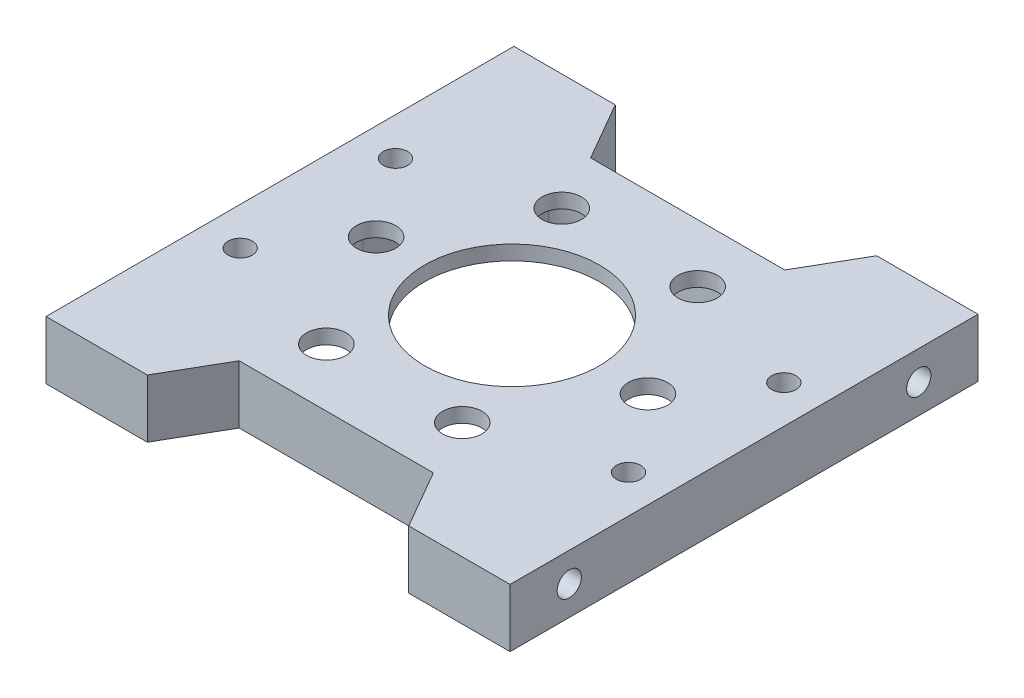
from build123d import *

# Parameters (mm, degrees)
SKETCH_1_R          = 35
SKETCH_1_R_2        = 2.025
SKETCH_1_R_3        = 9
SKETCH_1_R_4        = 1.25
EXTRUDE_1_DEPTH     = 3
CUT_EXTRUDE_1_REACH = 51.86
SKETCH_2_R          = 35
SKETCH_2_W          = 47.8
SKETCH_2_H          = 48.2
SKETCH_3_R          = 1.25
CUT_EXTRUDE_2_DEPTH = 8
SKETCH_5_R          = 9
SKETCH_5_R_2        = 3.75
SKETCH_5_R_3        = 2.025
CUT_EXTRUDE_4_DEPTH = 4.5
CUT_EXTRUDE_6_DEPTH = 35.467666007


with BuildPart() as part:
    # 草图1 → 凸台-拉伸1 (new, symmetric)
    with BuildSketch(Plane(origin=(0, 0, 0), x_dir=(1, 0, 0), z_dir=(0, 1, 0))):
        with Locations(Location((0, 0, 0), (0, 0, 270))):
            Circle(SKETCH_1_R)
        with Locations(Location((14, 0, 0), (0, 0, 270))):
            Circle(SKETCH_1_R_2, mode=Mode.SUBTRACT)
        with Locations(Location((7, -12.124355653, 0), (0, 0, 270))):
            Circle(SKETCH_1_R_2, mode=Mode.SUBTRACT)
        with Locations(Location((-7, -12.124355653, 0), (0, 0, 270))):
            Circle(SKETCH_1_R_2, mode=Mode.SUBTRACT)
        with Locations(Location((-14, 0, 0), (0, 0, 270))):
            Circle(SKETCH_1_R_2, mode=Mode.SUBTRACT)
        with Locations(Location((-7, 12.124355653, 0), (0, 0, 270))):
            Circle(SKETCH_1_R_2, mode=Mode.SUBTRACT)
        with Locations(Location((7, 12.124355653, 0), (0, 0, 270))):
            Circle(SKETCH_1_R_2, mode=Mode.SUBTRACT)
        with Locations(Location((0, 0, 0), (0, 0, 270))):
            Circle(SKETCH_1_R_3, mode=Mode.SUBTRACT)
        with Locations(Location((-20, 8, 0), (0, 0, 270))):
            Circle(SKETCH_1_R_4, mode=Mode.SUBTRACT)
        with Locations(Location((-20, -8, 0), (0, 0, 90))):
            Circle(SKETCH_1_R_4, mode=Mode.SUBTRACT)
        with Locations(Location((20, -8, 0), (0, 0, 270))):
            Circle(SKETCH_1_R_4, mode=Mode.SUBTRACT)
        with Locations(Location((20, 8, 0), (0, 0, 90))):
            Circle(SKETCH_1_R_4, mode=Mode.SUBTRACT)
    extrude(amount=EXTRUDE_1_DEPTH, both=True)

    # 草图2 → 切除-拉伸1 (cut, up to next)
    with BuildSketch(Plane(origin=(0, 3, 0), x_dir=(1, 0, 0), z_dir=(0, 1, 0)), mode=Mode.PRIVATE) as cut_extrude_1_sk1:
        Circle(SKETCH_2_R)
        Rectangle(SKETCH_2_W, SKETCH_2_H, mode=Mode.SUBTRACT)
    cut_extrude_1_tool1 = extrude(cut_extrude_1_sk1.sketch, amount=-CUT_EXTRUDE_1_REACH, mode=Mode.PRIVATE) & part.part
    add(cut_extrude_1_tool1.solids().sort_by_distance((-34.010051, 3, 0))[0], mode=Mode.SUBTRACT)

    # 草图3 → 切除-拉伸2 (cut)
    with BuildSketch(Plane.ZY.offset(23.9)):
        with Locations((18, 0)):
            Circle(SKETCH_3_R)
        with Locations(Location((-18, 0, 0), (0, 0, 180))):
            Circle(SKETCH_3_R)
    cut_extrude_2 = extrude(amount=-CUT_EXTRUDE_2_DEPTH, mode=Mode.SUBTRACT)

    # 草图5 → 切除-拉伸4 (cut)
    # profile 1 of 7: a face of its own
    with BuildSketch(Plane.XZ.offset(3)):
        with BuildLine():
            Line((7, 15.874355653), (-7, 15.874355653))
            ThreePointArc((-7, 15.874355653), (-4.348349571, 14.776006082), (-3.25, 12.124355653))
            ThreePointArc((-3.25, 12.124355653), (-7.970571419, 8.502133804), (-10.247595264, 13.999355653))
            Line((-10.247595264, 13.999355653), (-17.247595264, 1.875))
            ThreePointArc((-17.247595264, 1.875), (-13.029428581, 3.622221849), (-10.25, 0))
            ThreePointArc((-10.25, 0), (-13.029428581, -3.622221849), (-17.247595264, -1.875))
            Line((-17.247595264, -1.875), (-10.247595264, -13.999355653))
            ThreePointArc((-10.247595264, -13.999355653), (-7.970571419, -8.502133804), (-3.25, -12.124355653))
            ThreePointArc((-3.25, -12.124355653), (-4.348349571, -14.776006082), (-7, -15.874355653))
            Line((-7, -15.874355653), (7, -15.874355653))
            ThreePointArc((7, -15.874355653), (4.348349571, -9.472705224), (10.75, -12.124355653))
            ThreePointArc((10.75, -12.124355653), (10.622221849, -13.094927072), (10.247595264, -13.999355653))
            Line((10.247595264, -13.999355653), (17.247595264, -1.875))
            ThreePointArc((17.247595264, -1.875), (10.25, 0), (17.247595264, 1.875))
            Line((17.247595264, 1.875), (10.247595264, 13.999355653))
            ThreePointArc((10.247595264, 13.999355653), (10.622221849, 13.094927072), (10.75, 12.124355653))
            ThreePointArc((10.75, 12.124355653), (4.348349571, 9.472705224), (7, 15.874355653))
        make_face()
        with Locations(Location((0, 0, 0), (0, 0, 270))):
            Circle(SKETCH_5_R, mode=Mode.SUBTRACT)
    # profile 2 of 7: a face of its own
    with BuildSketch(Plane.XZ.offset(3)):
        with Locations((-14, 0)):
            Circle(SKETCH_5_R_2)
        with Locations(Location((-14, 0, 0), (0, 0, 270))):
            Circle(SKETCH_5_R_3, mode=Mode.SUBTRACT)
    # profile 3 of 7: a face of its own
    with BuildSketch(Plane.XZ.offset(3)):
        with Locations((-7, 12.124355653)):
            Circle(SKETCH_5_R_2)
        with Locations(Location((-7, 12.124355653, 0), (0, 0, 270))):
            Circle(SKETCH_5_R_3, mode=Mode.SUBTRACT)
    # profile 4 of 7: a face of its own
    with BuildSketch(Plane.XZ.offset(3)):
        with Locations((7, 12.124355653)):
            Circle(SKETCH_5_R_2)
        with Locations(Location((7, 12.124355653, 0), (0, 0, 270))):
            Circle(SKETCH_5_R_3, mode=Mode.SUBTRACT)
    # profile 5 of 7: a face of its own
    with BuildSketch(Plane.XZ.offset(3)):
        with Locations((14, 0)):
            Circle(SKETCH_5_R_2)
        with Locations(Location((14, 0, 0), (0, 0, 270))):
            Circle(SKETCH_5_R_3, mode=Mode.SUBTRACT)
    # profile 6 of 7: a face of its own
    with BuildSketch(Plane.XZ.offset(3)):
        with Locations((7, -12.124355653)):
            Circle(SKETCH_5_R_2)
        with Locations(Location((7, -12.124355653, 0), (0, 0, 270))):
            Circle(SKETCH_5_R_3, mode=Mode.SUBTRACT)
    # profile 7 of 7: a face of its own
    with BuildSketch(Plane.XZ.offset(3)):
        with Locations((-7, -12.124355653)):
            Circle(SKETCH_5_R_2)
        with Locations(Location((-7, -12.124355653, 0), (0, 0, 270))):
            Circle(SKETCH_5_R_3, mode=Mode.SUBTRACT)
    extrude(amount=-CUT_EXTRUDE_4_DEPTH, mode=Mode.SUBTRACT)

    # 镜向1: 切除-拉伸2 across plane
    add(cut_extrude_2.mirror(Plane(origin=(0, 0, 0), x_dir=(0, 0, 1), z_dir=(1, 0, 0))), mode=Mode.SUBTRACT)

    # 草图7 → 切除-拉伸6 (cut, through all)
    with BuildSketch(Plane.XZ.offset(3)):
        Polygon((-13.464101615, 24.1), (-10, 18.1), (10, 18.1), (13.464101615, 24.1), align=None)
        Polygon((10, -18.1), (-10, -18.1), (-13.464101615, -24.1), (13.464101615, -24.1), align=None)
    extrude(amount=-CUT_EXTRUDE_6_DEPTH, mode=Mode.SUBTRACT)


solid = part.part
